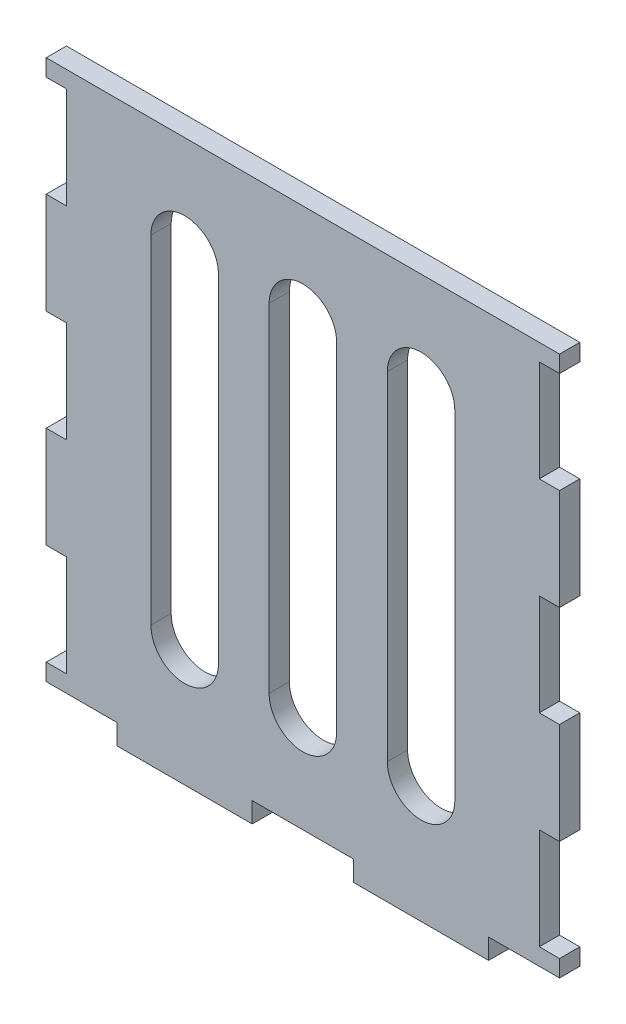
from build123d import *

# Parameters (mm, degrees)
BOSS_EXTRUDE1_DEPTH = 3


with BuildPart() as part:
    # Sketch1 → Boss-Extrude1 (new body)
    with BuildSketch(Plane.XY):
        Polygon((-38, 40), (-38, 37.5), (-35, 37.5), (-35, 22.5), (-38, 22.5), (-38, 7.5), (-35, 7.5), (-35, -7.5), (-38, -7.5), (-38, -22.5), (-35, -22.5), (-35, -37.5), (-38, -37.5), (-38, -40), (-27.5, -40), (-27.5, -43), (-7.5, -43), (-7.5, -40), (7.5, -40), (7.5, -43), (27.5, -43), (27.5, -40), (38, -40), (38, -37.5), (35, -37.5), (35, -22.5), (38, -22.5), (38, -7.5), (35, -7.5), (35, 7.5), (38, 7.5), (38, 22.5), (35, 22.5), (35, 37.5), (38, 37.5), (38, 40), align=None)
        with BuildLine():
            Line((-12.5, 25), (-12.5, -25))
            ThreePointArc((-12.5, -25), (-17.5, -30), (-22.5, -25))
            Line((-22.5, -25), (-22.5, 25))
            ThreePointArc((-22.5, 25), (-17.5, 30), (-12.5, 25))
        make_face(mode=Mode.SUBTRACT)
        with BuildLine():
            ThreePointArc((5, -25), (0, -30), (-5, -25))
            Line((-5, -25), (-5, 25))
            ThreePointArc((-5, 25), (0, 30), (5, 25))
            Line((5, 25), (5, -25))
        make_face(mode=Mode.SUBTRACT)
        with BuildLine():
            ThreePointArc((22.5, -25), (17.5, -30), (12.5, -25))
            Line((12.5, -25), (12.5, 25))
            ThreePointArc((12.5, 25), (17.5, 30), (22.5, 25))
            Line((22.5, 25), (22.5, -25))
        make_face(mode=Mode.SUBTRACT)
    extrude(amount=BOSS_EXTRUDE1_DEPTH)


solid = part.part
